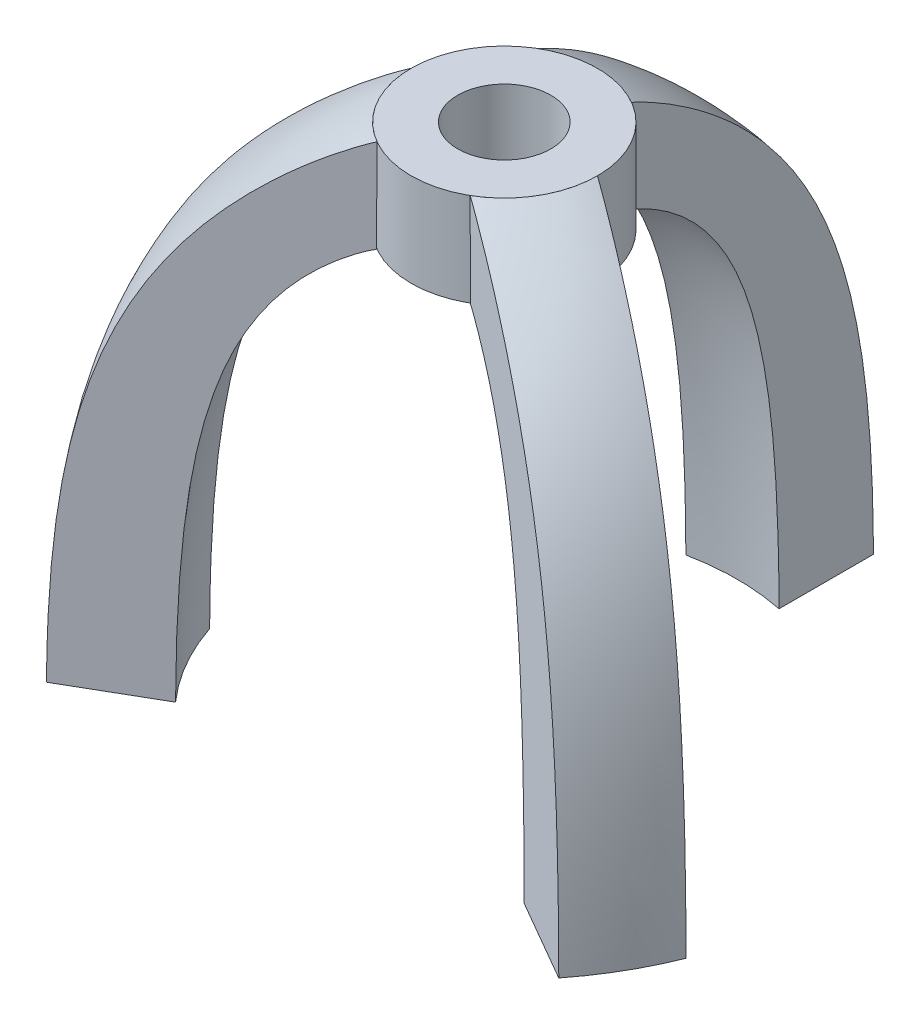
from build123d import *

# Parameters (mm, degrees)
SKETCH2_R           = 6.35
SKETCH2_R_2         = 3.175
BOSS_EXTRUDE1_DEPTH = 6.35
CUT_EXTRUDE1_DEPTH  = 47.985709432


with BuildPart() as part:
    # Sketch2 → Boss-Extrude1 (new body)
    with BuildSketch(Plane(origin=(0, 0, 0), x_dir=(1, 0, 0), z_dir=(0, 1, 0))):
        with Locations(Location((0, 0, 0), (0, 0, 270))):
            Circle(SKETCH2_R)
        with Locations(Location((0, 0, 0), (0, 0, 270))):
            Circle(SKETCH2_R_2, mode=Mode.SUBTRACT)
    extrude(amount=BOSS_EXTRUDE1_DEPTH)


with BuildPart() as body_2:
    # Sketch6 → Revolve1 (revolve)
    with BuildSketch(Plane.XY, mode=Mode.PRIVATE) as revolve1_sk:
        with BuildLine():
            Line((15.875, -28.575), (22.225, -28.575))
            add(Edge.make_bspline(
                [(6.35, 6.35), (7.467751563, 5.782243558), (18.756333032, -0.329761449), (22.102006344, -8.871607917), (22.225, -28.575)],
                knots=[0, 0, 0, 0, 0, 1, 1, 1, 1, 1], degree=4))
            Line((6.35, 6.35), (6.374007583, 0))
            add(Edge.make_bspline(
                [(6.374007583, 0), (7.73903602, -0.567756442), (13.445964189, -3.811497044), (15.810261971, -9.729776165), (15.875, -28.575)],
                knots=[0, 0, 0, 0, 0, 1, 1, 1, 1, 1], degree=4))
        make_face()
    revolve(revolve1_sk.sketch.rotate(Axis((0, 0, 0), (0, 1, 0)), 90), axis=Axis((0, 0, 0), (0, 1, 0)))

    # Sketch8 → Cut-Extrude1 (cut, through all)
    with BuildSketch(Plane(origin=(0, 6.35, 0), x_dir=(1, 0, 0), z_dir=(0, 1, 0))):
        with BuildLine():
            ThreePointArc((-6.35, 0), (-5.499261314, 3.175), (-3.175, 5.499261314))
            Line((-3.175, 5.499261314), (-3.175, 21.997045256))
            ThreePointArc((-3.175, 21.997045256), (-19.247414599, 11.1125), (-20.6375, -8.248891971))
            Line((-20.6375, -8.248891971), (-6.35, 0))
        make_face()
        with BuildLine():
            Line((3.175, 21.997045256), (3.175, 5.499261314))
            ThreePointArc((3.175, 5.499261314), (5.499261314, 3.175), (6.35, 0))
            Line((6.35, 0), (20.6375, -8.248891971))
            ThreePointArc((20.6375, -8.248891971), (21.824516747, -4.200130206), (22.225, 0))
            ThreePointArc((22.225, 0), (16.800520825, 14.549677831), (3.175, 21.997045256))
        make_face()
        with BuildLine():
            ThreePointArc((3.175, -5.499261314), (0, -6.35), (-3.175, -5.499261314))
            Line((-3.175, -5.499261314), (-17.4625, -13.748153285))
            ThreePointArc((-17.4625, -13.748153285), (0, -22.225), (17.4625, -13.748153285))
            Line((17.4625, -13.748153285), (3.175, -5.499261314))
        make_face()
    extrude(amount=-CUT_EXTRUDE1_DEPTH, mode=Mode.SUBTRACT)


with BuildPart() as cut_extrude1_piece_1:
    # of the separate pieces the step leaves, piece 1, a body of its own (cut_extrude1_pieces)
    add(body_2.part.solids().sort_by_distance((-15.057884182, -28.575, 5.027499276))[0])


with BuildPart() as cut_extrude1_piece_2:
    # of the separate pieces the step leaves, piece 2, a body of its own (cut_extrude1_pieces)
    add(body_2.part.solids().sort_by_distance((11.882884182, -28.575, 10.52676059))[0])


with BuildPart() as cut_extrude1_piece_3:
    # of the separate pieces the step leaves, piece 3, a body of its own (cut_extrude1_pieces)
    add(body_2.part.solids().sort_by_distance((3.175, -28.575, -15.554259867))[0])


solid = Compound([part.part, cut_extrude1_piece_1.part, cut_extrude1_piece_2.part, cut_extrude1_piece_3.part])
